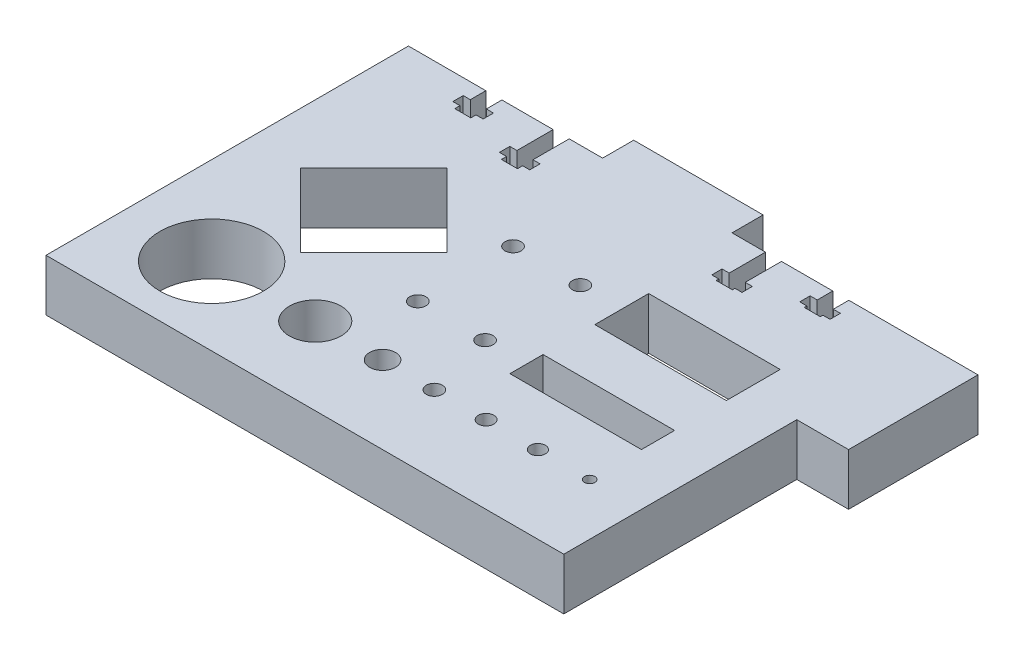
from build123d import *

# Parameters (mm, degrees)
SZKIC1_R                    = 1
SZKIC1_R_2                  = 1.5
SZKIC1_R_3                  = 1.55
SZKIC1_R_4                  = 2.5
SZKIC1_R_5                  = 5
SZKIC1_R_6                  = 10
SZKIC1_R_7                  = 1.45
SZKIC1_W                    = 25.4
SZKIC1_H                    = 6.4
SZKIC1_H_2                  = 10.4
DODANIE_WYCI_GNI_CIE1_DEPTH = 10


with BuildPart() as part:
    # Szkic1 → Dodanie-wyciągnięcie1 (new body)
    with BuildSketch(Plane(origin=(0, 0, 0), x_dir=(1, 0, 0), z_dir=(0, 1, 0))):
        Polygon((208.426283919, -256.077576053), (233.376283919, -256.077576053), (233.376283919, -281.077576053), (223.376283919, -281.077576053), (223.376283919, -326.077576053), (123.376283919, -326.077576053), (123.376283919, -256.077576053), (138.326283919, -256.077576053), (138.326283919, -259.077576053), (136.951283919, -259.077576053), (136.951283919, -261.077576053), (138.326283919, -261.077576053), (138.326283919, -262.077576053), (141.426283919, -262.077576053), (141.426283919, -261.077576053), (142.801283919, -261.077576053), (142.801283919, -259.077576053), (141.426283919, -259.077576053), (141.426283919, -256.077576053), (151.326283919, -256.077576053), (151.326283919, -263.077576053), (149.951283919, -263.077576053), (149.951283919, -265.077576053), (151.326283919, -265.077576053), (151.326283919, -266.077576053), (154.426283919, -266.077576053), (154.426283919, -265.077576053), (155.801283919, -265.077576053), (155.801283919, -263.077576053), (154.426283919, -263.077576053), (154.426283919, -256.077576053), (160.876283919, -256.077576053), (160.876283919, -250.077576053), (185.876283919, -250.077576053), (185.876283919, -256.077576053), (192.326283919, -256.077576053), (192.326283919, -263.077576053), (190.951283919, -263.077576053), (190.951283919, -265.077576053), (192.326283919, -265.077576053), (192.326283919, -265.577576053), (195.426283919, -265.577576053), (195.426283919, -265.077576053), (196.801283919, -265.077576053), (196.801283919, -263.077576053), (195.426283919, -263.077576053), (195.426283919, -256.077576053), (205.326283919, -256.077576053), (205.326283919, -259.077576053), (203.951283919, -259.077576053), (203.951283919, -261.077576053), (205.326283919, -261.077576053), (205.326283919, -261.577576053), (208.426283919, -261.577576053), (208.426283919, -261.077576053), (209.801283919, -261.077576053), (209.801283919, -259.077576053), (208.426283919, -259.077576053), align=None)
        with Locations(Location((213.376283919, -311.077576053, 0), (0, 0, 270))):
            Circle(SZKIC1_R, mode=Mode.SUBTRACT)
        with Locations(Location((193.376283919, -311.077576053, 0), (0, 0, 270))):
            Circle(SZKIC1_R_2, mode=Mode.SUBTRACT)
        with Locations(Location((183.376283919, -311.077576053, 0), (0, 0, 270))):
            Circle(SZKIC1_R_3, mode=Mode.SUBTRACT)
        with Locations(Location((173.376283919, -311.077576053, 0), (0, 0, 270))):
            Circle(SZKIC1_R_4, mode=Mode.SUBTRACT)
        with Locations(Location((160.376283919, -311.077576053, 0), (0, 0, 270))):
            Circle(SZKIC1_R_5, mode=Mode.SUBTRACT)
        with Locations(Location((140.376283919, -311.077576053, 0), (0, 0, 270))):
            Circle(SZKIC1_R_6, mode=Mode.SUBTRACT)
        with Locations(Location((179.976283919, -279.477576053, 0), (0, 0, 270))):
            Circle(SZKIC1_R_3, mode=Mode.SUBTRACT)
        with Locations(Location((166.976283919, -279.477576053, 0), (0, 0, 270))):
            Circle(SZKIC1_R_3, mode=Mode.SUBTRACT)
        with Locations(Location((179.976283919, -297.877576053, 0), (0, 0, 270))):
            Circle(SZKIC1_R_3, mode=Mode.SUBTRACT)
        with Locations(Location((166.976283919, -297.877576053, 0), (0, 0, 270))):
            Circle(SZKIC1_R_3, mode=Mode.SUBTRACT)
        with Locations(Location((203.376283919, -311.077576053, 0), (0, 0, 270))):
            Circle(SZKIC1_R_7, mode=Mode.SUBTRACT)
        with Locations((200.676283919, -297.877576053)):
            Rectangle(SZKIC1_W, SZKIC1_H, mode=Mode.SUBTRACT)
        with Locations((200.676283919, -279.477576053)):
            Rectangle(SZKIC1_W, SZKIC1_H_2, mode=Mode.SUBTRACT)
        Polygon((161.660555166, -286.935440429), (147.518419543, -272.793304805), (133.376283919, -286.935440429), (147.518419543, -301.077576053), align=None, mode=Mode.SUBTRACT)
    extrude(amount=DODANIE_WYCI_GNI_CIE1_DEPTH)


solid = part.part
